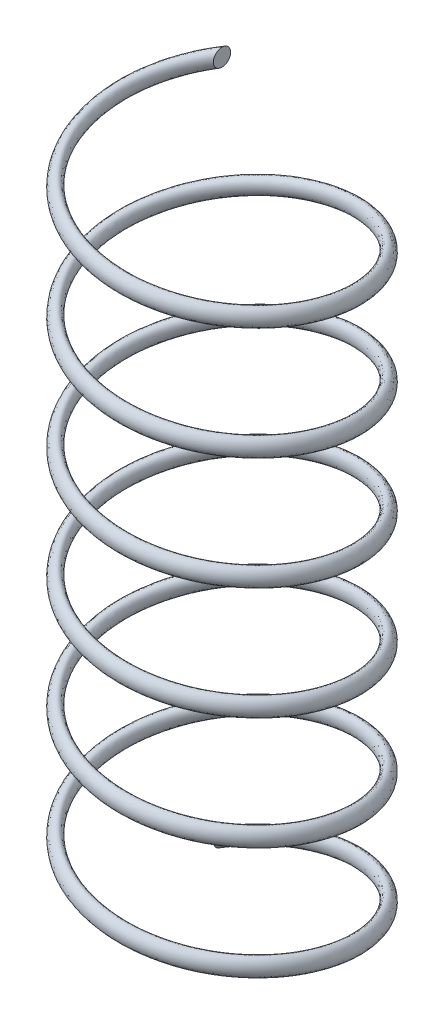
from build123d import *

# Parameters (mm, degrees)
BALAYAGE1_PITCH       = 3.25
BALAYAGE1_HEIGHT      = 19.5
BALAYAGE1_RADIUS      = 3.4
BALAYAGE1_START_ANGLE = -135
ESQUISSE5_R           = 0.25


with BuildPart() as part:
    # Balayage1: sweep along a helix
    with BuildLine() as balayage1_path:
        add(Helix(BALAYAGE1_PITCH, BALAYAGE1_HEIGHT, BALAYAGE1_RADIUS, center=(0, 0, 0), direction=(0, 1, 0), lefthand=True, mode=Mode.PRIVATE).rotate(Axis((0, 0, 0), (0, 1, 0)), BALAYAGE1_START_ANGLE))
    # Esquisse5 → Balayage1 (sweep)
    with BuildSketch(Plane(origin=(-2.404163056, 0, 0), x_dir=(0, 0, -1), z_dir=(1, 0, 0))):
        with Locations((2.404163056, 0)):
            Circle(ESQUISSE5_R)
    sweep(path=balayage1_path.line, is_frenet=True)


solid = part.part
